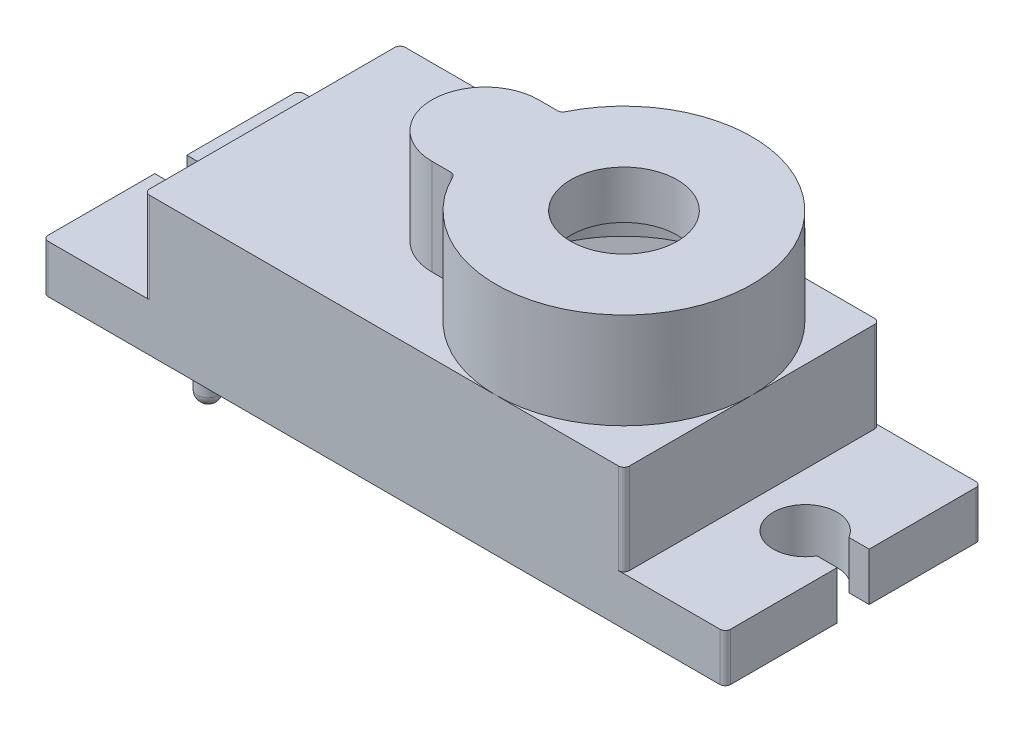
from build123d import *

# Parameters (mm, degrees)
SKETCH1_W            = 22.5
SKETCH1_H            = 12
BOSS_EXTRUDE1_DEPTH  = 6.5
SKETCH2_W            = 22.5
SKETCH2_H            = 12
BOSS_EXTRUDE2_DEPTH  = 0.5
BOSS_EXTRUDE3_DEPTH  = 4.5
BOSS_EXTRUDE4_START  = -1
SKETCH4_R            = 2.5
BOSS_EXTRUDE4_DEPTH  = 1
CUT_EXTRUDE1_DEPTH   = 15.311271781
BOSS_EXTRUDE5_START  = 1.25
SKETCH6_R            = 3
SKETCH6_R_2          = 2.5
BOSS_EXTRUDE5_DEPTH  = 1.25
BOSS_EXTRUDE7_DEPTH  = 2.25
BOSS_EXTRUDE8_START  = -1
BOSS_EXTRUDE8_DEPTH  = 1
SKETCH9_R            = 0.625
CUT_EXTRUDE2_DEPTH   = 0.25
SKETCH11_R           = 1.125
SKETCH11_R_2         = 0.5
BOSS_EXTRUDE9_DEPTH  = 6
SKETCH12_R           = 0.5
BOSS_EXTRUDE10_DEPTH = 2
FILLET1_R            = 0.5
FILLET2_R            = 0.25
CUT_EXTRUDE3_DEPTH   = 6


with BuildPart() as part:
    # Sketch1 → Boss-Extrude1 (new body)
    with BuildSketch(Plane(origin=(0, 0, 0), x_dir=(1, 0, 0), z_dir=(0, 1, 0))):
        Rectangle(SKETCH1_W, SKETCH1_H)
        Polygon((10.25, 5), (-10.25, 5), (-10.75, 5), (-10.75, -5), (-10.25, -5), (10.25, -5), (10.75, -5), (10.75, 5), align=None, mode=Mode.SUBTRACT)
    extrude(amount=BOSS_EXTRUDE1_DEPTH)

    # Sketch2 → Boss-Extrude2 (add)
    with BuildSketch(Plane(origin=(0, 6.5, 0), x_dir=(1, 0, 0), z_dir=(0, 1, 0))):
        Rectangle(SKETCH2_W, SKETCH2_H)
    extrude(amount=-BOSS_EXTRUDE2_DEPTH)

    # Sketch3 → Boss-Extrude3 (add)
    with BuildSketch(Plane(origin=(0, 6.5, 0), x_dir=(1, 0, 0), z_dir=(0, 1, 0))):
        with BuildLine():
            Line((-1.25, 2.5), (-0.204356057, 2.5))
            ThreePointArc((-0.204356057, 2.5), (11.25, 0), (-0.204356057, -2.5))
            Line((-0.204356057, -2.5), (-1.25, -2.5))
            ThreePointArc((-1.25, -2.5), (-3.75, 0), (-1.25, 2.5))
        make_face()
        with BuildLine():
            Line((-1.25, 2.1), (0.058661059, 2.1))
            ThreePointArc((0.058661059, 2.1), (10.85, 0), (0.058661059, -2.1))
            Line((0.058661059, -2.1), (-1.25, -2.1))
            ThreePointArc((-1.25, -2.1), (-3.35, 0), (-1.25, 2.1))
        make_face(mode=Mode.SUBTRACT)
    extrude(amount=BOSS_EXTRUDE3_DEPTH)

    # Sketch4 → Boss-Extrude4 (add)
    with BuildSketch(Plane(origin=(0, 11, 0), x_dir=(1, 0, 0), z_dir=(0, 1, 0)).offset(BOSS_EXTRUDE4_START)):
        with BuildLine():
            ThreePointArc((-1.25, -2.1), (-3.35, 0), (-1.25, 2.1))
            Line((-1.25, 2.1), (0.058661059, 2.1))
            ThreePointArc((0.058661059, 2.1), (10.85, 0), (0.058661059, -2.1))
            Line((0.058661059, -2.1), (-1.25, -2.1))
        make_face()
        with Locations(Location((5.25, 0, 0), (0, 0, 270))):
            Circle(SKETCH4_R, mode=Mode.SUBTRACT)
    extrude(amount=BOSS_EXTRUDE4_DEPTH)

    # Sketch5 → Cut-Extrude1 (cut, through all)
    with BuildSketch(Plane(origin=(0, 6.5, 0), x_dir=(1, 0, 0), z_dir=(0, 1, 0))):
        with BuildLine():
            Line((-1.25, -2.1), (0.058661059, -2.1))
            ThreePointArc((0.058661059, -2.1), (10.85, 0), (0.058661059, 2.1))
            Line((0.058661059, 2.1), (-1.25, 2.1))
            ThreePointArc((-1.25, 2.1), (-3.35, 0), (-1.25, -2.1))
        make_face()
    extrude(amount=-CUT_EXTRUDE1_DEPTH, mode=Mode.SUBTRACT)

    # Sketch6 → Boss-Extrude5 (add)
    with BuildSketch(Plane.XZ.offset(-10).offset(BOSS_EXTRUDE5_START)):
        with Locations(Location((5.25, 0, 0), (0, 0, 90))):
            Circle(SKETCH6_R)
        with Locations(Location((5.25, 0, 0), (0, 0, 90))):
            Circle(SKETCH6_R_2, mode=Mode.SUBTRACT)
    extrude(amount=-BOSS_EXTRUDE5_DEPTH)

    # Sketch7 → Boss-Extrude7 (add)
    with BuildSketch(Plane(origin=(0, 0, 0), x_dir=(1, 0, 0), z_dir=(0, 1, 0))):
        with BuildLine():
            Line((-11.25, -6), (-11.25, 6))
            Line((-11.25, 6), (-16, 6))
            Line((-16, 6), (-16, 0.75))
            Line((-16, 0.75), (-15.049038106, 0.75))
            ThreePointArc((-15.049038106, 0.75), (-12.25, 0), (-15.049038106, -0.75))
            Line((-15.049038106, -0.75), (-16, -0.75))
            Line((-16, -0.75), (-16, -6))
            Line((-16, -6), (-11.25, -6))
        make_face()
        with BuildLine():
            Line((-15, 1.430908802), (-15, 5))
            Line((-15, 5), (-11.5, 5))
            Line((-11.5, 5), (-11.5, -5))
            Line((-11.5, -5), (-15, -5))
            Line((-15, -5), (-15, -1.430908802))
            ThreePointArc((-15, -1.430908802), (-11.85, 0), (-15, 1.430908802))
        make_face(mode=Mode.SUBTRACT)
    boss_extrude7 = extrude(amount=BOSS_EXTRUDE7_DEPTH)

    # Sketch8 → Boss-Extrude8 (add)
    with BuildSketch(Plane(origin=(0, 2.25, 0), x_dir=(1, 0, 0), z_dir=(0, 1, 0)).offset(BOSS_EXTRUDE8_START)):
        with BuildLine():
            Line((-15.049038106, 0.75), (-16, 0.75))
            Line((-16, 0.75), (-16, 6))
            Line((-16, 6), (-11.25, 6))
            Line((-11.25, 6), (-11.25, -6))
            Line((-11.25, -6), (-16, -6))
            Line((-16, -6), (-16, -0.75))
            Line((-16, -0.75), (-15.049038106, -0.75))
            ThreePointArc((-15.049038106, -0.75), (-12.25, 0), (-15.049038106, 0.75))
        make_face()
    boss_extrude8 = extrude(amount=BOSS_EXTRUDE8_DEPTH)

    # Mirror1: Boss-Extrude7, Boss-Extrude8 across plane
    add(boss_extrude7.mirror(Plane(origin=(0, 0, 0), x_dir=(0, 0, 1), z_dir=(1, 0, 0))))
    add(boss_extrude8.mirror(Plane(origin=(0, 0, 0), x_dir=(0, 0, 1), z_dir=(1, 0, 0))))

    # Sketch9 → Cut-Extrude2 (cut)
    with BuildSketch(Plane.XZ.offset(-10)):
        with Locations(Location((-1.25, 0, 0), (0, 0, 270))):
            Circle(SKETCH9_R)
    extrude(amount=-CUT_EXTRUDE2_DEPTH, mode=Mode.SUBTRACT)

    # Sketch11 → Boss-Extrude9 (add)
    # profile 1 of 4: a face of its own
    with BuildSketch(Plane.XZ.offset(-6)):
        with Locations((-9.75, 4.5)):
            Circle(SKETCH11_R)
    # profile 2 of 4: a face of its own
    with BuildSketch(Plane.XZ.offset(-6)):
        with Locations((-9.75, -4.5)):
            Circle(SKETCH11_R)
        with Locations(Location((-9.75, -4.5, 0), (0, 0, 90))):
            Circle(SKETCH11_R_2, mode=Mode.SUBTRACT)
    # profile 3 of 4: a face of its own
    with BuildSketch(Plane.XZ.offset(-6)):
        with Locations((9.75, -4.5)):
            Circle(SKETCH11_R)
    # profile 4 of 4: a face of its own
    with BuildSketch(Plane.XZ.offset(-6)):
        with Locations((9.75, 4.5)):
            Circle(SKETCH11_R)
        with Locations(Location((9.75, 4.5, 0), (0, 0, 90))):
            Circle(SKETCH11_R_2, mode=Mode.SUBTRACT)
    extrude(amount=BOSS_EXTRUDE9_DEPTH)

    # Sketch12 → Boss-Extrude10 (add)
    with BuildSketch(Plane.XZ):
        with Locations(Location((-9.75, 4.5, 0), (0, 0, 90))):
            Circle(SKETCH12_R)
        with Locations(Location((9.75, -4.5, 0), (0, 0, 90))):
            Circle(SKETCH12_R)
    extrude(amount=BOSS_EXTRUDE10_DEPTH)

    # Fillet1
    fillet1_edges = [part.edges().sort_by_distance(p)[0] for p in [
        (-9.75, -2, 4),
        (9.75, -2, -5),
    ]]
    fillet(fillet1_edges, radius=FILLET1_R)

    # Fillet2
    fillet2_edges = [part.edges().sort_by_distance(p)[0] for p in [
        (-16, 1.125, 6),
        (-16, 1.125, -6),
        (16, 1.125, -6),
        (16, 1.125, 6),
        (-0.204356057, 8.75, -2.5),
        (-0.204356057, 8.75, 2.5),
        (-11.25, 4.375, -6),
        (11.25, 4.375, -6),
        (11.25, 4.375, 6),
        (-11.25, 4.375, 6),
    ]]
    fillet(fillet2_edges, radius=FILLET2_R)

    # Sketch13 → Cut-Extrude3 (cut)
    with BuildSketch(Plane.XZ):
        with BuildLine():
            Line((0.058661059, 2.1), (0.058661059, -2.1))
            ThreePointArc((0.058661059, -2.1), (10.85, 0), (0.058661059, 2.1))
        make_face()
    extrude(amount=-CUT_EXTRUDE3_DEPTH, mode=Mode.SUBTRACT)


solid = part.part
